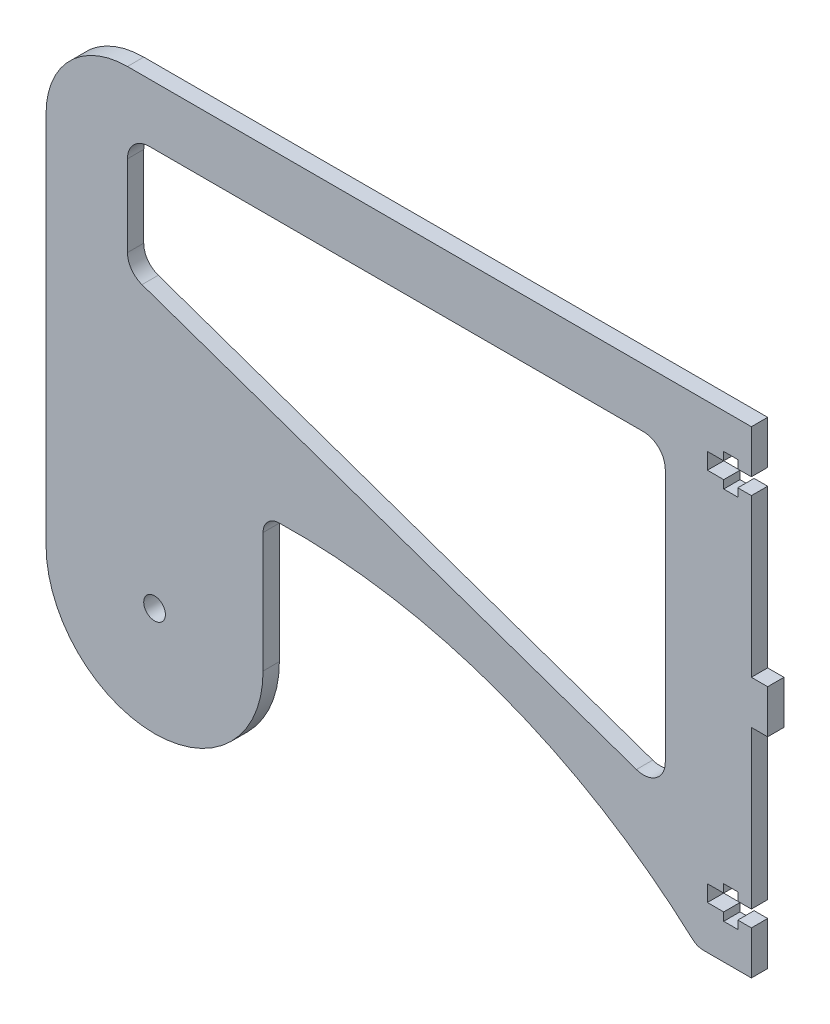
from build123d import *

# Parameters (mm, degrees)
SKETCH_1_R      = 2
EXTRUDE_1_DEPTH = 3


with BuildPart() as part:
    # 草图1 → 凸台-拉伸1 (new body)
    with BuildSketch(Plane.XY):
        with BuildLine():
            Line((364.002581869, 97.707860978), (354.002581869, 97.707860978))
            Line((354.002581869, 97.707860978), (249.002581869, 97.707860978))
            ThreePointArc((249.002581869, 97.707860978), (238.395980151, 93.314462696), (234.002581869, 82.707860978))
            Line((234.002581869, 82.707860978), (234.002581869, 13.707860978))
            ThreePointArc((234.002581869, 13.707860978), (254.002581869, -6.292139022), (274.002581869, 13.707860978))
            Line((274.002581869, 13.707860978), (274.002581869, 35.819123465))
            ThreePointArc((274.002581869, 35.819123465), (274.855620398, 37.914488932), (276.929619495, 38.818236083))
            ThreePointArc((276.929619495, 38.818236083), (317.768023154, 31.985283132), (353.154233351, 10.484571811))
            ThreePointArc((353.154233351, 10.484571811), (354.089046944, 9.908765811), (355.16842929, 9.707860978))
            Line((355.16842929, 9.707860978), (364.002581869, 9.707860978))
            Line((364.002581869, 9.707860978), (364.002581869, 17.707860978))
            Line((364.002581869, 17.707860978), (361.502581869, 17.707860978))
            Line((361.502581869, 17.707860978), (361.502581869, 16.207860978))
            Line((361.502581869, 16.207860978), (358.902581869, 16.207860978))
            Line((358.902581869, 16.207860978), (358.902581869, 17.707860978))
            Line((358.902581869, 17.707860978), (355.902581869, 17.707860978))
            Line((355.902581869, 17.707860978), (355.902581869, 20.707860978))
            Line((355.902581869, 20.707860978), (358.902581869, 20.707860978))
            Line((358.902581869, 20.707860978), (358.902581869, 22.207860978))
            Line((358.902581869, 22.207860978), (361.502581869, 22.207860978))
            Line((361.502581869, 22.207860978), (361.502581869, 20.707860978))
            Line((361.502581869, 20.707860978), (364.002581869, 20.707860978))
            Line((364.002581869, 20.707860978), (364.002581869, 49.707860978))
            Line((364.002581869, 49.707860978), (367.002581869, 49.707860978))
            Line((367.002581869, 49.707860978), (367.002581869, 57.707860978))
            Line((367.002581869, 57.707860978), (364.002581869, 57.707860978))
            Line((364.002581869, 57.707860978), (364.002581869, 86.707860978))
            Line((364.002581869, 86.707860978), (361.502581869, 86.707860978))
            Line((361.502581869, 86.707860978), (361.502581869, 85.207860978))
            Line((361.502581869, 85.207860978), (358.902581869, 85.207860978))
            Line((358.902581869, 85.207860978), (358.902581869, 86.707860978))
            Line((358.902581869, 86.707860978), (355.902581869, 86.707860978))
            Line((355.902581869, 86.707860978), (355.902581869, 89.707860978))
            Line((355.902581869, 89.707860978), (358.902581869, 89.707860978))
            Line((358.902581869, 89.707860978), (358.902581869, 91.207860978))
            Line((358.902581869, 91.207860978), (361.502581869, 91.207860978))
            Line((361.502581869, 91.207860978), (361.502581869, 89.707860978))
            Line((361.502581869, 89.707860978), (364.002581869, 89.707860978))
            Line((364.002581869, 89.707860978), (364.002581869, 97.707860978))
        make_face()
        with Locations((254.002581869, 13.707860978)):
            Circle(SKETCH_1_R, mode=Mode.SUBTRACT)
        with BuildLine():
            Line((253.002581869, 86.967009497), (344.129272471, 86.967009497))
            ThreePointArc((344.129272471, 86.967009497), (346.957699596, 85.795436622), (348.129272471, 82.967009497))
            Line((348.129272471, 82.967009497), (348.129272471, 36.172406577))
            ThreePointArc((348.129272471, 36.172406577), (346.444858552, 32.910802508), (342.810241921, 32.396144085))
            Line((342.810241921, 32.396144085), (251.683551319, 64.226264226))
            ThreePointArc((251.683551319, 64.226264226), (249.740977801, 65.686940637), (249.002581869, 68.002526718))
            Line((249.002581869, 68.002526718), (249.002581869, 82.967009497))
            ThreePointArc((249.002581869, 82.967009497), (250.174154745, 85.795436622), (253.002581869, 86.967009497))
        make_face(mode=Mode.SUBTRACT)
    extrude(amount=EXTRUDE_1_DEPTH)


solid = part.part
